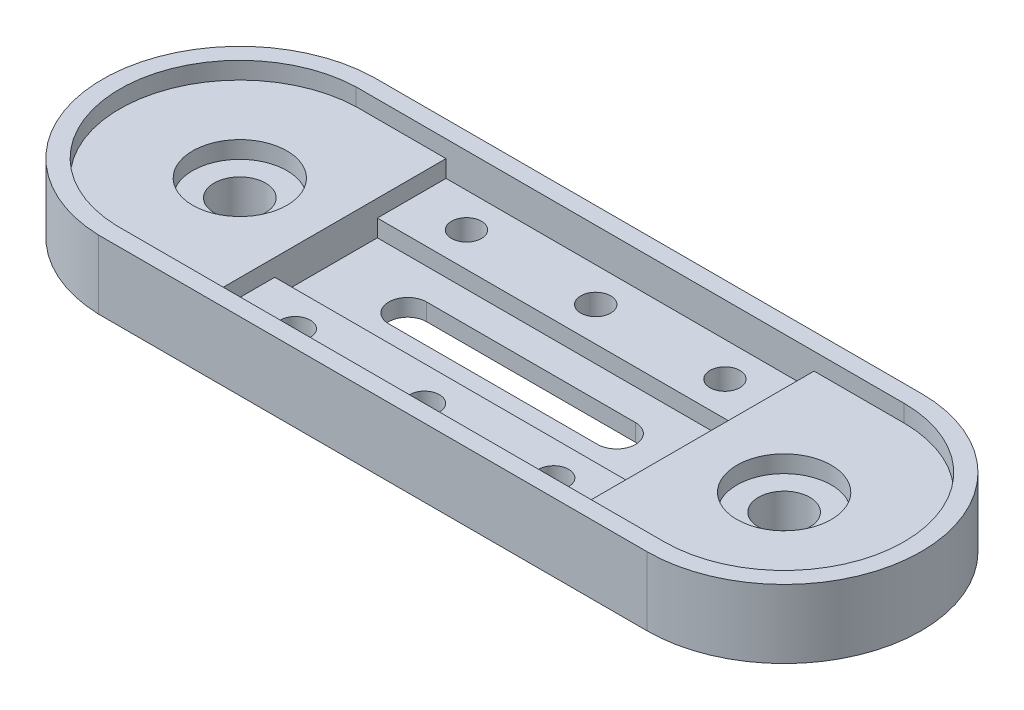
from build123d import *

# Parameters (mm, degrees)
EXTRUDE1_DEPTH                                       = 12.7
EXTRUDE2_DEPTH                                       = 3.175
SKETCH3_W                                            = 68.191134733
SKETCH3_H                                            = 44.45
EXTRUDE3_DEPTH                                       = 3.175
SKETCH4_W                                            = 68.191134733
SKETCH4_H                                            = 19.005533376
EXTRUDE4_DEPTH                                       = 3.175
EXTRUDE6_DEPTH                                       = 137.930502446
CBORE_FOR_1_4_BINDING_HEAD_MACHINE_SCREW_D           = 9.525
CBORE_FOR_1_4_BINDING_HEAD_MACHINE_SCREW_CBORE_D     = 17.4752
CBORE_FOR_1_4_BINDING_HEAD_MACHINE_SCREW_CBORE_DEPTH = 3.175
F_7_32_0_21875_DIAMETER_HOLE1_D                      = 5.55625
F_7_32_0_21875_DIAMETER_HOLE1_DEPTH                  = 25.4
F_7_32_0_21875_DIAMETER_HOLE1_TIP                    = 1.669265907
F_7_32_0_21875_DIAMETER_HOLE2_D                      = 5.55625
F_7_32_0_21875_DIAMETER_HOLE2_DEPTH                  = 25.4
F_7_32_0_21875_DIAMETER_HOLE2_TIP                    = 1.669265907


with BuildPart() as part:
    # Sketch1 → Extrude1 (new body)
    with BuildSketch(Plane(origin=(0, 0, 0), x_dir=(1, 0, 0), z_dir=(0, 1, 0))):
        with BuildLine():
            Line((0, 0), (101.6, 0))
            ThreePointArc((101.6, 0), (127, 25.4), (101.6, 50.8))
            Line((101.6, 50.8), (0, 50.8))
            ThreePointArc((0, 50.8), (-24.665230296, 25.4), (0, 0))
        make_face()
    extrude(amount=-EXTRUDE1_DEPTH)

    # Sketch2 → Extrude2 (cut)
    with BuildSketch(Plane(origin=(0, 0, 0), x_dir=(1, 0, 0), z_dir=(0, 1, 0))):
        with BuildLine():
            Line((101.6, 47.625), (0.048151693, 47.625))
            ThreePointArc((0.048151693, 47.625), (-21.490230296, 25.4), (0.048151693, 3.175))
            Line((0.048151693, 3.175), (101.6, 3.175))
            ThreePointArc((101.6, 3.175), (123.825, 25.4), (101.6, 47.625))
        make_face()
    extrude(amount=-EXTRUDE2_DEPTH, mode=Mode.SUBTRACT)

    # Sketch3 → Extrude3 (cut)
    with BuildSketch(Plane(origin=(0, -3.175, 0), x_dir=(-1, 0, 0), z_dir=(0, 1, 0))):
        with Locations((-50.824075847, -25.4)):
            Rectangle(SKETCH3_W, SKETCH3_H)
    extrude(amount=-EXTRUDE3_DEPTH, mode=Mode.SUBTRACT)

    # Sketch4 → Extrude4 (cut)
    with BuildSketch(Plane(origin=(0, -6.35, 0), x_dir=(-1, 0, 0), z_dir=(0, 1, 0))):
        with Locations((-50.824075847, -25.4)):
            Rectangle(SKETCH4_W, SKETCH4_H)
    extrude(amount=-EXTRUDE4_DEPTH, mode=Mode.SUBTRACT)

    # Sketch6 → Extrude6 (cut, through all)
    with BuildSketch(Plane(origin=(0, -6.35, 0), x_dir=(-1, 0, 0), z_dir=(0, 1, 0))):
        with BuildLine():
            Line((-70.286653385, -22.157058497), (-31.585524424, -22.157058497))
            ThreePointArc((-31.585524424, -22.157058497), (-28.07443844, -25.668144481), (-31.585524424, -29.179230465))
            Line((-31.585524424, -29.179230465), (-70.286653385, -29.179230465))
            ThreePointArc((-70.286653385, -29.179230465), (-73.797739369, -25.668144481), (-70.286653385, -22.157058497))
        make_face()
    extrude(amount=-EXTRUDE6_DEPTH, mode=Mode.SUBTRACT)

    # CBORE for 1/4 Binding Head Machine Screw2 (through all)
    with Locations(Plane(origin=(0, -3.175, 0), x_dir=(-1, 0, 0), z_dir=(0, 1, 0))):
        with Locations((-0.745713987, -25.4), (-101.6, -25.4)):
            CounterBoreHole(CBORE_FOR_1_4_BINDING_HEAD_MACHINE_SCREW_D / 2, CBORE_FOR_1_4_BINDING_HEAD_MACHINE_SCREW_CBORE_D / 2, CBORE_FOR_1_4_BINDING_HEAD_MACHINE_SCREW_CBORE_DEPTH)

    # 7/32 (0.21875) Diameter Hole1
    with Locations(Plane(origin=(0, -6.35, 0), x_dir=(-1, 0, 0), z_dir=(0, 1, 0))):
        with Locations((-26.882460023, -9.536116656)):
            Hole(F_7_32_0_21875_DIAMETER_HOLE1_D / 2, depth=F_7_32_0_21875_DIAMETER_HOLE1_DEPTH)
            with Locations((0, 0, -(F_7_32_0_21875_DIAMETER_HOLE1_DEPTH + F_7_32_0_21875_DIAMETER_HOLE1_TIP / 2))):  # 118° drill point
                Cone(0, F_7_32_0_21875_DIAMETER_HOLE1_D / 2, F_7_32_0_21875_DIAMETER_HOLE1_TIP, mode=Mode.SUBTRACT)

    # 7/32 (0.21875) Diameter Hole2
    with Locations(Plane(origin=(0, -6.35, 0), x_dir=(-1, 0, 0), z_dir=(0, 1, 0))):
        with Locations((-50.824075847, -9.536116656), (-74.76569167, -9.536116656), (-26.882460023, -41.263883344), (-50.824075847, -41.263883344), (-74.76569167, -41.263883344)):
            Hole(F_7_32_0_21875_DIAMETER_HOLE2_D / 2, depth=F_7_32_0_21875_DIAMETER_HOLE2_DEPTH)
            with Locations((0, 0, -(F_7_32_0_21875_DIAMETER_HOLE2_DEPTH + F_7_32_0_21875_DIAMETER_HOLE2_TIP / 2))):  # 118° drill point
                Cone(0, F_7_32_0_21875_DIAMETER_HOLE2_D / 2, F_7_32_0_21875_DIAMETER_HOLE2_TIP, mode=Mode.SUBTRACT)


solid = part.part
